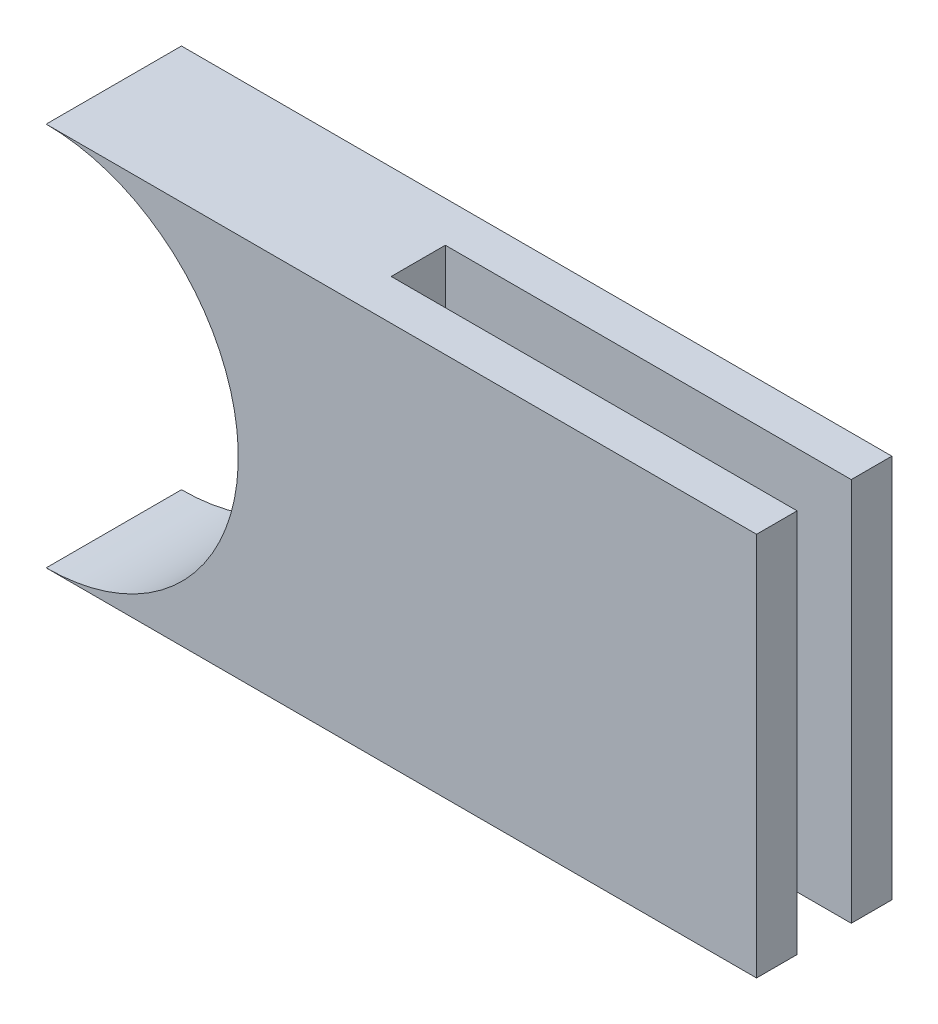
from build123d import *

# Parameters (mm, degrees)
SKETCH1_R                = 19.939
CIRCLE_EXTRUDE_DEPTH     = 12.7
SKETCH3_W                = 12.7
SKETCH3_H                = 39.878
RECTANGLE_EXTRUDE_DEPTH  = 68.58
SKETCH2_R                = 18.034
CRICLE_CUT_DEPTH         = 73.54012766
SKETCH4_OUTSIDE_W        = 110.101
SKETCH4_OUTSIDE_H        = 61.46
SKETCH4_OUTSIDE_W_2      = 66.675
SKETCH4_OUTSIDE_H_2      = 36.068
FRAME_CUT_DEPTH          = 73.54012766
SKETCH13_W               = 5.08
SKETCH13_H               = 36.068
BACK_CUT_DEPTH           = 38.1
SKETCH14_R               = 1.905
FOR_SPRING_EXTRUDE_DEPTH = 2.54


with BuildPart() as part:
    # Sketch1 → circle extrude (new body)
    with BuildSketch(Plane.XY):
        Circle(SKETCH1_R)
    extrude(amount=CIRCLE_EXTRUDE_DEPTH)

    # Sketch3 → rectangle extrude (add)
    with BuildSketch(Plane(origin=(0, 0, 0), x_dir=(0, 0, -1), z_dir=(1, 0, 0))):
        with Locations((-6.35, 0)):
            Rectangle(SKETCH3_W, SKETCH3_H)
    extrude(amount=RECTANGLE_EXTRUDE_DEPTH)

    # Sketch2 → cricle cut (cut, through all)
    with BuildSketch(Plane.XY.offset(12.7)):
        Circle(SKETCH2_R)
    extrude(amount=-CRICLE_CUT_DEPTH, mode=Mode.SUBTRACT)

    # Sketch4 outside → frame cut (cut, through all)
    with BuildSketch(Plane.XY.offset(12.7)):
        with Locations((24.3205, 0)):
            Rectangle(SKETCH4_OUTSIDE_W, SKETCH4_OUTSIDE_H)
        with Locations((33.3375, 0)):
            Rectangle(SKETCH4_OUTSIDE_W_2, SKETCH4_OUTSIDE_H_2, mode=Mode.SUBTRACT)
    extrude(amount=-FRAME_CUT_DEPTH, mode=Mode.SUBTRACT)

    # Sketch13 → back cut (cut)
    with BuildSketch(Plane(origin=(66.675, 0, 0), x_dir=(0, 0, -1), z_dir=(1, 0, 0))):
        with Locations((-6.35, 0)):
            Rectangle(SKETCH13_W, SKETCH13_H)
    extrude(amount=-BACK_CUT_DEPTH, mode=Mode.SUBTRACT)

    # Sketch14 → for spring extrude (add)
    with BuildSketch(Plane(origin=(28.575, 0, 0), x_dir=(0, 0, -1), z_dir=(1, 0, 0))):
        with Locations((-6.35, 0)):
            Circle(SKETCH14_R)
    extrude(amount=FOR_SPRING_EXTRUDE_DEPTH)


solid = part.part
